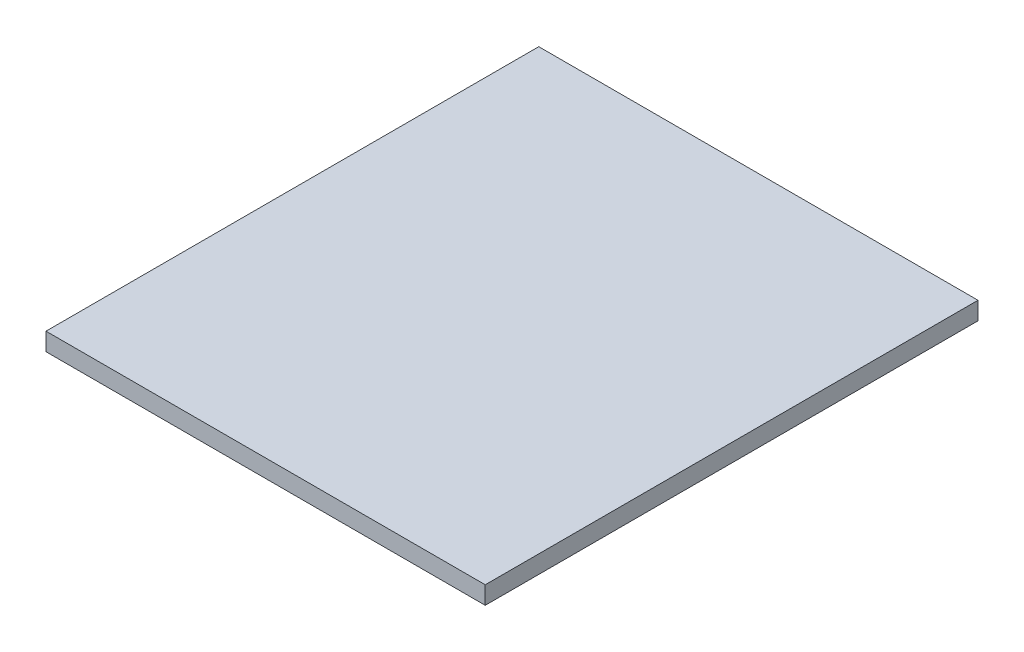
from build123d import *

# Parameters (mm, degrees)
CROQUIS1_W              = 1252.4
CROQUIS1_H              = 1405
SALIENTE_EXTRUIR1_DEPTH = 50.8


with BuildPart() as part:
    # Croquis1 → Saliente-Extruir1 (new body)
    with BuildSketch(Plane(origin=(0, 0, 0), x_dir=(1, 0, 0), z_dir=(0, 1, 0))):
        with Locations((626.2, -702.5)):
            Rectangle(CROQUIS1_W, CROQUIS1_H)
    extrude(amount=SALIENTE_EXTRUIR1_DEPTH)


solid = part.part
